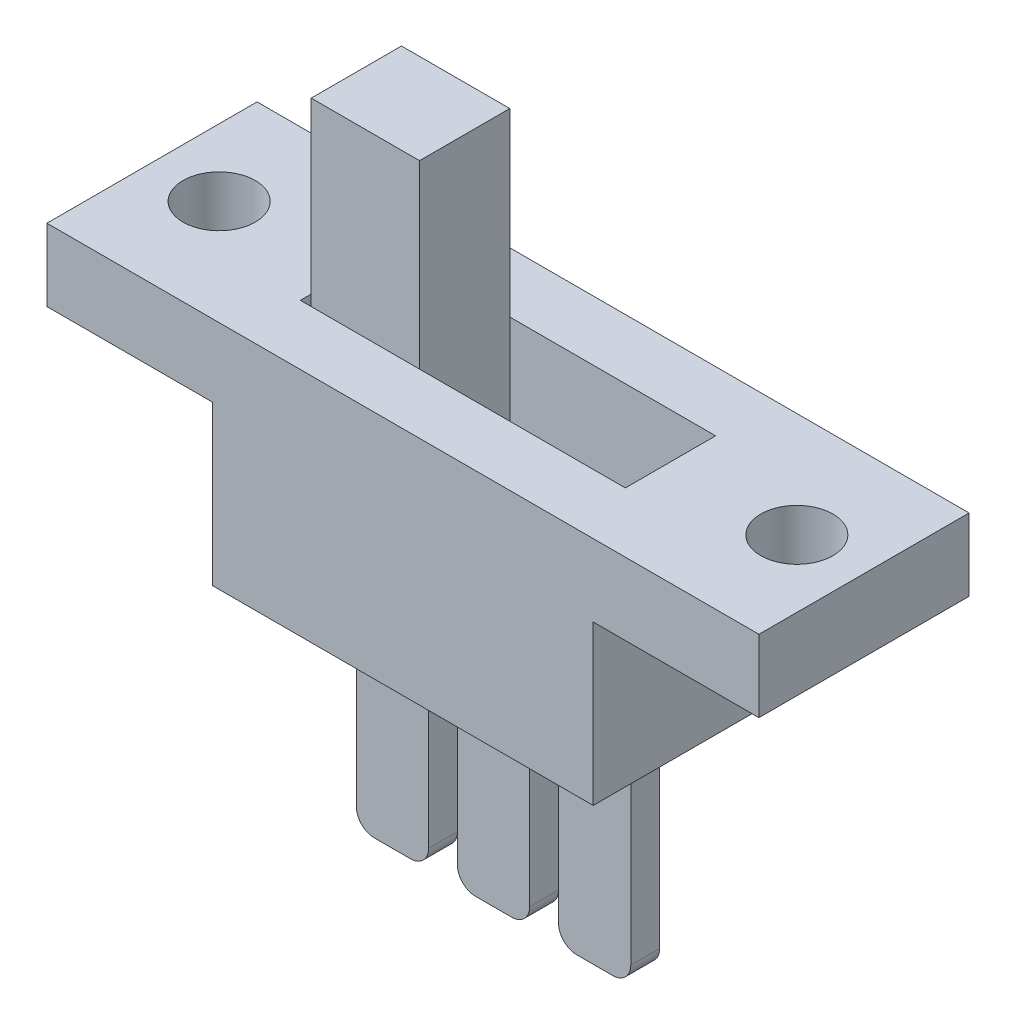
from build123d import *

# Parameters (mm, degrees)
SKETCH1_W               = 19.72
SKETCH1_H               = 5.82
SKETCH1_R               = 1
BOSS_EXTRUDE1_DEPTH     = 2
SKETCH1_3_W             = 10.54
SKETCH1_3_H             = 5.82
BOSS_EXTRUDE2_DEPTH     = 4.4
CUT_EXTRUDE1_DEPTH      = 12.182472893
CUT_EXTRUDE1_DEPTH_BACK = 3
SKETCH1_4_W             = 9
SKETCH1_4_H             = 2.5
BOSS_EXTRUDE3_START     = -3
SKETCH1_5_W             = 3
SKETCH1_5_H             = 2.5
BOSS_EXTRUDE3_DEPTH     = 5
BOSS_EXTRUDE4_START     = 2
SKETCH1_6_W             = 3
SKETCH1_6_H             = 2.5
BOSS_EXTRUDE4_DEPTH     = 5
BOSS_EXTRUDE5_START     = -4.4
SKETCH2_W               = 2
SKETCH2_H               = 0.8
BOSS_EXTRUDE5_DEPTH     = 6.32
FILLET1_R               = 0.5


with BuildPart() as part:
    # Sketch1 → Boss-Extrude1 (new body)
    with BuildSketch(Plane(origin=(0, 0, 0), x_dir=(1, 0, 0), z_dir=(0, 1, 0))):
        Rectangle(SKETCH1_W, SKETCH1_H)
        with Locations(Location((8, 0, 0), (0, 0, 270))):
            Circle(SKETCH1_R, mode=Mode.SUBTRACT)
        with Locations(Location((-8, 0, 0), (0, 0, 270))):
            Circle(SKETCH1_R, mode=Mode.SUBTRACT)
    extrude(amount=BOSS_EXTRUDE1_DEPTH)

    # Sketch1<3> → Boss-Extrude2 (add)
    with BuildSketch(Plane(origin=(0, 0, 0), x_dir=(1, 0, 0), z_dir=(0, 1, 0))):
        Rectangle(SKETCH1_3_W, SKETCH1_3_H)
    extrude(amount=-BOSS_EXTRUDE2_DEPTH)

    # Sketch1<4> → Cut-Extrude1 (cut, two sides: drawn at the far end of the back side and taken through both)
    with BuildSketch(Plane(origin=(0, 0, 0), x_dir=(1, 0, 0), z_dir=(0, 1, 0)).offset(-CUT_EXTRUDE1_DEPTH_BACK)):
        Rectangle(SKETCH1_4_W, SKETCH1_4_H)
    extrude(amount=CUT_EXTRUDE1_DEPTH + CUT_EXTRUDE1_DEPTH_BACK, mode=Mode.SUBTRACT)

    # Sketch1<5> → Boss-Extrude3 (add)
    with BuildSketch(Plane(origin=(0, 0, 0), x_dir=(1, 0, 0), z_dir=(0, 1, 0)).offset(BOSS_EXTRUDE3_START)):
        with Locations((-2.7, 0)):
            Rectangle(SKETCH1_5_W, SKETCH1_5_H)
    extrude(amount=BOSS_EXTRUDE3_DEPTH)

    # Sketch1<6> → Boss-Extrude4 (add)
    with BuildSketch(Plane(origin=(0, 0, 0), x_dir=(1, 0, 0), z_dir=(0, 1, 0)).offset(BOSS_EXTRUDE4_START)):
        with Locations((-2.7, 0)):
            Rectangle(SKETCH1_6_W, SKETCH1_6_H)
    extrude(amount=BOSS_EXTRUDE4_DEPTH)

    # Sketch2 → Boss-Extrude5 (add)
    with BuildSketch(Plane(origin=(0, 0, 0), x_dir=(1, 0, 0), z_dir=(0, 1, 0)).offset(BOSS_EXTRUDE5_START)):
        with Locations((-2.8, 0)):
            Rectangle(SKETCH2_W, SKETCH2_H)
        Rectangle(SKETCH2_W, SKETCH2_H)
        with Locations((2.8, 0)):
            Rectangle(SKETCH2_W, SKETCH2_H)
    extrude(amount=-BOSS_EXTRUDE5_DEPTH)

    # Fillet1
    fillet1_edges = [part.edges().sort_by_distance(p)[0] for p in [
        (1.8, -10.72, 0),
        (3.8, -10.72, 0),
        (-3.8, -10.72, 0),
        (-1.8, -10.72, 0),
        (-1, -10.72, 0),
        (1, -10.72, 0),
    ]]
    fillet(fillet1_edges, radius=FILLET1_R)


solid = part.part
